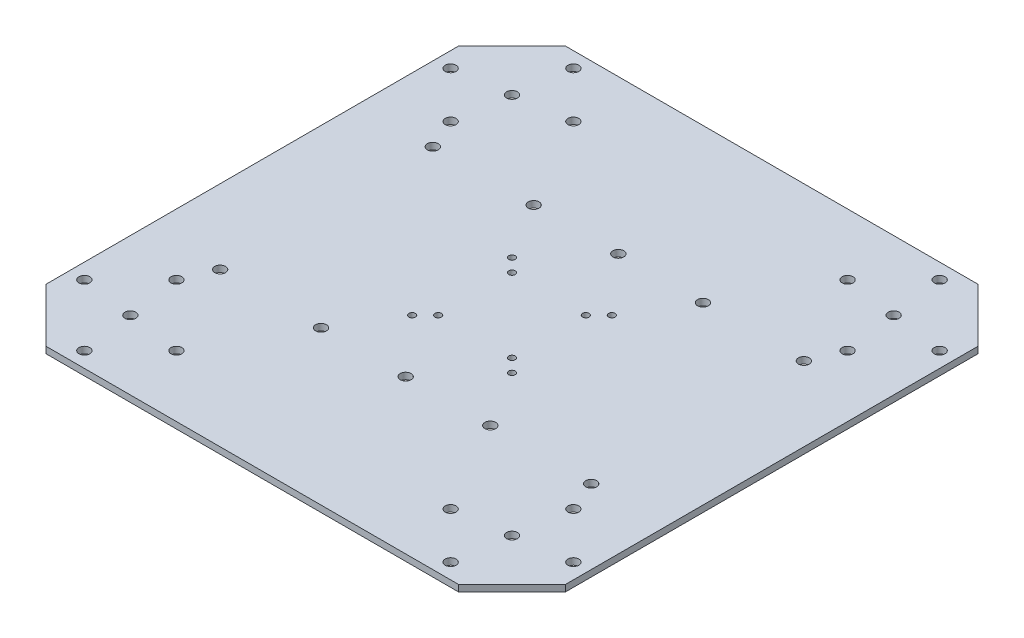
from build123d import *

# Parameters (mm, degrees)
BOSS_EXTRUDE1_DEPTH = 3
BOSS_EXTRUDE2_DEPTH = 2
SKETCH3_R           = 2.5
CUT_EXTRUDE1_DEPTH  = 3
SKETCH4_R           = 1.5
CUT_EXTRUDE2_DEPTH  = 10
SKETCH5_R           = 2.5
CUT_EXTRUDE3_DEPTH  = 4
SKETCH6_R           = 2.5
CUT_EXTRUDE6_DEPTH  = 188.014816174


with BuildPart() as part:
    # Sketch1 → Boss-Extrude1 (new body)
    with BuildSketch(Plane(origin=(0, 0, 0), x_dir=(1, 0, 0), z_dir=(0, 1, 0))):
        Polygon((-72.724629944, 121.633442715), (117.275370056, 121.633442715), (142.024107398, 96.884705373), (142.024107398, -93.115294627), (117.275370056, -117.864031968), (-72.724629944, -117.864031968), (-97.473367285, -93.115294627), (-97.473367285, 96.884705373), align=None)
    extrude(amount=BOSS_EXTRUDE1_DEPTH)

    # Sketch2 → Boss-Extrude2 (add)
    with BuildSketch(Plane(origin=(0, 3, 0), x_dir=(1, 0, 0), z_dir=(0, 1, 0))):
        Polygon((-97.473367285, -93.115294627), (-58.58249432, -54.224421662), (-33.833756978, -78.973159003), (-72.724629944, -117.864031968), align=None)
        Polygon((142.024107398, -93.115294627), (106.643904841, -53.574025356), (80.60097798, -76.876363508), (117.275370056, -117.864031968), align=None)
        Polygon((117.275370056, 121.633442715), (77.827961767, 85.647210429), (101.391526244, 59.817289105), (142.024107398, 96.884705373), align=None)
        Polygon((-72.724629944, 121.633442715), (-36.009112401, 80.682609127), (-62.030072457, 57.352851665), (-97.473367285, 96.884705373), align=None)
    extrude(amount=-BOSS_EXTRUDE2_DEPTH)

    # Sketch3 → Cut-Extrude1 (cut)
    with BuildSketch(Plane(origin=(0, 3, 0), x_dir=(1, 0, 0), z_dir=(0, 1, 0))):
        with Locations(Location((134.953039586, -82.508692909, 0), (0, 0, 270))):
            Circle(SKETCH3_R)
        with Locations(Location((106.668768338, -110.792964157, 0), (0, 0, 270))):
            Circle(SKETCH3_R)
        with Locations(Location((85.455564903, -89.579760721, 0), (0, 0, 270))):
            Circle(SKETCH3_R)
        with Locations(Location((113.73983615, -61.295489474, 0), (0, 0, 270))):
            Circle(SKETCH3_R)
        with Locations(Location((106.668768338, 114.562374903, 0), (0, 0, 270))):
            Circle(SKETCH3_R)
        with Locations(Location((134.953039586, 86.278103655, 0), (0, 0, 270))):
            Circle(SKETCH3_R)
        with Locations(Location((113.73983615, 65.06490022, 0), (0, 0, 270))):
            Circle(SKETCH3_R)
        with Locations(Location((85.455564903, 93.349171467, 0), (0, 0, 270))):
            Circle(SKETCH3_R)
        with Locations(Location((-62.118028226, 114.562374903, 0), (0, 0, 270))):
            Circle(SKETCH3_R)
        with Locations(Location((-90.402299473, 86.278103655, 0), (0, 0, 270))):
            Circle(SKETCH3_R)
        with Locations(Location((-69.189096038, 65.06490022, 0), (0, 0, 270))):
            Circle(SKETCH3_R)
        with Locations(Location((-40.90482479, 93.349171467, 0), (0, 0, 270))):
            Circle(SKETCH3_R)
        with Locations(Location((-40.90482479, -89.579760721, 0), (0, 0, 270))):
            Circle(SKETCH3_R)
        with Locations(Location((-69.189096038, -61.295489474, 0), (0, 0, 270))):
            Circle(SKETCH3_R)
        with Locations(Location((-62.118028226, -110.792964157, 0), (0, 0, 270))):
            Circle(SKETCH3_R)
        with Locations(Location((-90.402299473, -82.508692909, 0), (0, 0, 270))):
            Circle(SKETCH3_R)
    extrude(amount=-CUT_EXTRUDE1_DEPTH, mode=Mode.SUBTRACT)

    # Sketch4 → Cut-Extrude2 (cut)
    with BuildSketch(Plane(origin=(0, 3, 0), x_dir=(1, 0, 0), z_dir=(0, 1, 0))):
        with Locations(Location((39.275370056, -15.115294627, 0), (0, 0, 270))):
            Circle(SKETCH4_R)
        with Locations(Location((45.275370056, -21.115294627, 0), (0, 0, 270))):
            Circle(SKETCH4_R)
        with Locations(Location((39.275370056, 18.884705373, 0), (0, 0, 270))):
            Circle(SKETCH4_R)
        with Locations(Location((45.275370056, 24.884705373, 0), (0, 0, 270))):
            Circle(SKETCH4_R)
        with Locations(Location((5.275370056, 18.884705373, 0), (0, 0, 270))):
            Circle(SKETCH4_R)
        with Locations(Location((-0.724629944, 24.884705373, 0), (0, 0, 270))):
            Circle(SKETCH4_R)
        with Locations(Location((5.275370056, -15.115294627, 0), (0, 0, 270))):
            Circle(SKETCH4_R)
        with Locations(Location((-0.724629944, -21.115294627, 0), (0, 0, 270))):
            Circle(SKETCH4_R)
    extrude(amount=-CUT_EXTRUDE2_DEPTH, mode=Mode.SUBTRACT)

    # Sketch5 → Cut-Extrude3 (cut)
    with BuildSketch(Plane(origin=(0, 3, 0), x_dir=(1, 0, 0), z_dir=(0, 1, 0))):
        with Locations(Location((-65.653562132, 89.813637561, 0), (0, 0, 270))):
            Circle(SKETCH5_R)
        with Locations(Location((110.204302244, 89.813637561, 0), (0, 0, 270))):
            Circle(SKETCH5_R)
        with Locations(Location((110.204302244, -86.044226815, 0), (0, 0, 270))):
            Circle(SKETCH5_R)
        with Locations(Location((-65.653562132, -86.044226815, 0), (0, 0, 270))):
            Circle(SKETCH5_R)
    extrude(amount=-CUT_EXTRUDE3_DEPTH, mode=Mode.SUBTRACT)

    # Sketch6 → Cut-Extrude6 (cut, through all)
    with BuildSketch(Plane(origin=(0, 3, 0), x_dir=(1, 0, 0), z_dir=(0, 1, 0))):
        with Locations(Location((-63.224629944, -47.115294627, 0), (0, 0, 270))):
            Circle(SKETCH6_R)
        with Locations(Location((-63.224629944, 50.884705373, 0), (0, 0, 270))):
            Circle(SKETCH6_R)
        with Locations(Location((107.775370056, 50.884705373, 0), (0, 0, 270))):
            Circle(SKETCH6_R)
        with Locations(Location((107.775370056, -47.115294627, 0), (0, 0, 270))):
            Circle(SKETCH6_R)
        with Locations(Location((61.275370056, -47.115294627, 0), (0, 0, 270))):
            Circle(SKETCH6_R)
        with Locations(Location((22.275370056, -47.115294627, 0), (0, 0, 270))):
            Circle(SKETCH6_R)
        with Locations(Location((-16.724629944, -47.115294627, 0), (0, 0, 270))):
            Circle(SKETCH6_R)
        with Locations(Location((-16.724629944, 50.884705373, 0), (0, 0, 270))):
            Circle(SKETCH6_R)
        with Locations(Location((22.275370056, 50.884705373, 0), (0, 0, 270))):
            Circle(SKETCH6_R)
        with Locations(Location((61.275370056, 50.884705373, 0), (0, 0, 270))):
            Circle(SKETCH6_R)
    extrude(amount=-CUT_EXTRUDE6_DEPTH, mode=Mode.SUBTRACT)


solid = part.part
